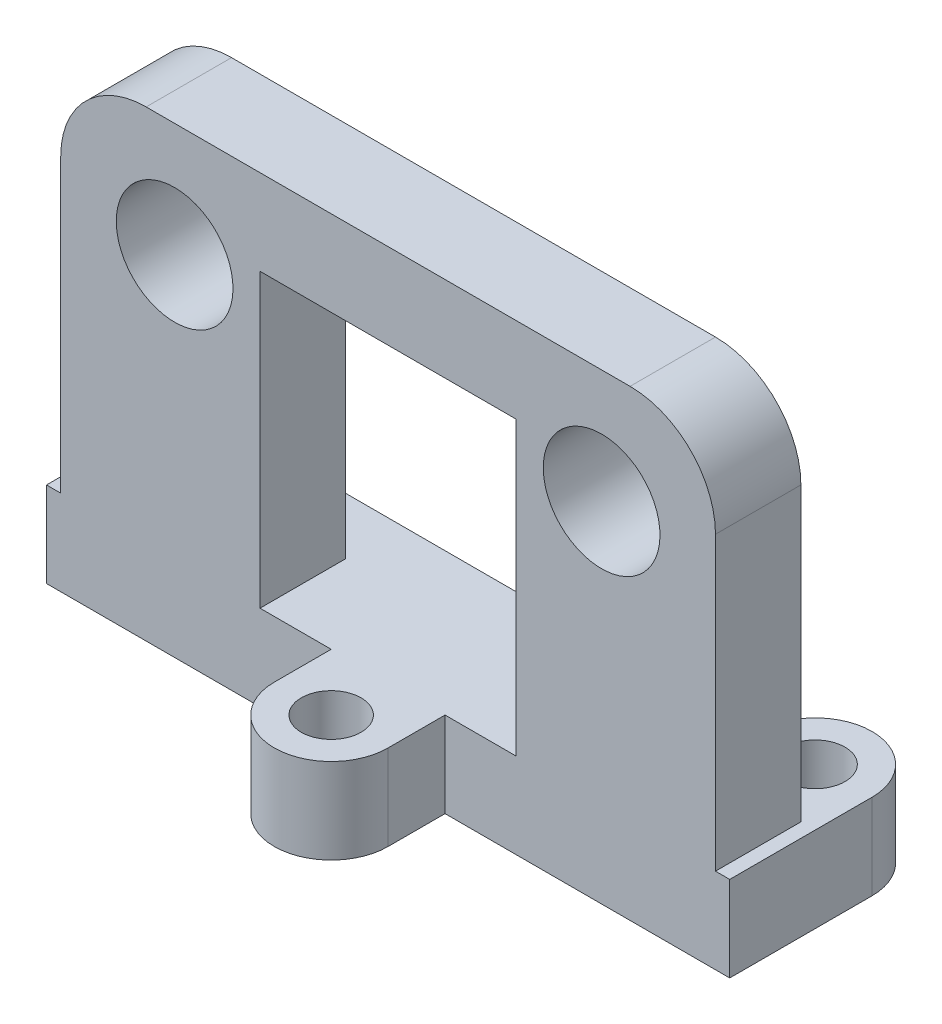
from build123d import *

# Parameters (mm, degrees)
EXTRUDE_1_DEPTH         = 23
HOLE_WIZARD_4_1_4_1_1_D = 4.1
SKETCH_5_W              = 9
SKETCH_5_H              = 13.25
CUT_EXTRUDE_1_DEPTH     = 21
EXTRUDE_2_DEPTH         = 3
HOLE_WIZARD_2_1_2_1_1_D = 2.1
SKETCH_12_W             = 3
SKETCH_12_H             = 3
EXTRUDE_4_DEPTH         = 9
FILLET_1_R              = 3


with BuildPart() as part:
    # 草图1 → 凸台-拉伸1 (new body)
    with BuildSketch(Plane(origin=(0, 0, 0), x_dir=(0, 0, -1), z_dir=(1, 0, 0))):
        Polygon((0, 0), (0, 16.25), (3, 16.25), (3, 3), (5, 3), (5, 0), align=None)
    extrude(amount=EXTRUDE_1_DEPTH)

    # Ø4.1 (4.1) 直径孔1 (through all)
    with Locations(Plane(origin=(0, 0, -3), x_dir=(-1, 0, 0), z_dir=(0, 0, -1))):
        with Locations((-4, 12.25), (-19, 12.25)):
            Hole(HOLE_WIZARD_4_1_4_1_1_D / 2)

    # 草图5 → 切除-拉伸1 (cut)
    with BuildSketch(Plane(origin=(0, 0, -3), x_dir=(-1, 0, 0), z_dir=(0, 0, -1))):
        with Locations((-11.5, 9.625)):
            Rectangle(SKETCH_5_W, SKETCH_5_H)
    extrude(amount=-CUT_EXTRUDE_1_DEPTH, mode=Mode.SUBTRACT)

    # 草图6 → 凸台-拉伸2 (add)
    with BuildSketch(Plane(origin=(0, 3, 0), x_dir=(1, 0, 0), z_dir=(0, 1, 0))):
        with BuildLine():
            ThreePointArc((3.5, 5), (1.5, 7), (-0.5, 5))
            Line((-0.5, 5), (-0.5, 0))
            Line((-0.5, 0), (0, 0))
            Line((0, 0), (0, 5))
            Line((0, 5), (3.5, 5))
        make_face()
        with BuildLine():
            Line((9.5, 0), (9.5, -2))
            ThreePointArc((9.5, -2), (11.5, -4), (13.5, -2))
            Line((13.5, -2), (13.5, 0))
            Line((13.5, 0), (9.5, 0))
        make_face()
        with BuildLine():
            Line((23.5, 0), (23.5, 5))
            ThreePointArc((23.5, 5), (21.5, 7), (19.5, 5))
            Line((19.5, 5), (23, 5))
            Line((23, 5), (23, 0))
            Line((23, 0), (23.5, 0))
        make_face()
    extrude(amount=-EXTRUDE_2_DEPTH)

    # Ø2.1 (2.1) 直径孔1 (through all)
    with Locations(Plane(origin=(0, 3, 0), x_dir=(1, 0, 0), z_dir=(0, 1, 0))):
        with Locations((1.5, 5), (11.5, -2), (21.5, 5)):
            Hole(HOLE_WIZARD_2_1_2_1_1_D / 2)

    # 草图12 → 凸台-拉伸4 (add)
    with BuildSketch(Plane.ZY.offset(-16)):
        with Locations((-1.5, 14.75)):
            Rectangle(SKETCH_12_W, SKETCH_12_H)
    extrude(amount=EXTRUDE_4_DEPTH)

    # 圆角1
    fillet_1_edges = [part.edges().sort_by_distance(p)[0] for p in [
        (23, 16.25, -1.5),
        (0, 16.25, -1.5),
    ]]
    fillet(fillet_1_edges, radius=FILLET_1_R)


solid = part.part
